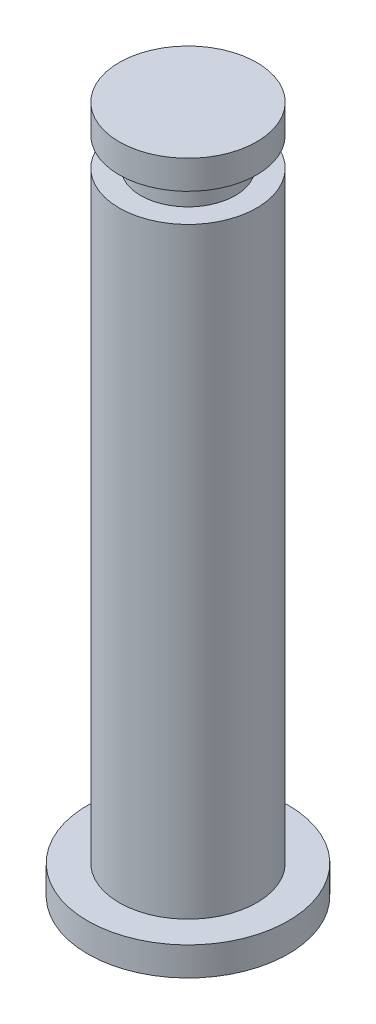
from build123d import *

# Parameters (mm, degrees)
CROQUIS1_R              = 3.5
CROQUIS1_R_2            = 2.4
SALIENTE_EXTRUIR1_DEPTH = 1
CROQUIS1_2_R            = 2.4
SALIENTE_EXTRUIR2_DEPTH = 24
CORTAR_EXTRUIR1_START   = -2
CROQUIS2_R              = 2.4
CROQUIS2_R_2            = 1.65
CORTAR_EXTRUIR1_DEPTH   = 1


with BuildPart() as part:
    # Croquis1 → Saliente-Extruir1 (new body)
    with BuildSketch(Plane(origin=(0, 0, 0), x_dir=(1, 0, 0), z_dir=(0, 1, 0))):
        Circle(CROQUIS1_R)
        Circle(CROQUIS1_R_2, mode=Mode.SUBTRACT)
    extrude(amount=SALIENTE_EXTRUIR1_DEPTH)

    # Croquis1<2> → Saliente-Extruir2 (add)
    with BuildSketch(Plane(origin=(0, 0, 0), x_dir=(1, 0, 0), z_dir=(0, 1, 0))):
        Circle(CROQUIS1_2_R)
    extrude(amount=SALIENTE_EXTRUIR2_DEPTH)

    # Croquis2 → Cortar-Extruir1 (cut)
    with BuildSketch(Plane(origin=(0, 24, 0), x_dir=(1, 0, 0), z_dir=(0, 1, 0)).offset(CORTAR_EXTRUIR1_START)):
        Circle(CROQUIS2_R)
        Circle(CROQUIS2_R_2, mode=Mode.SUBTRACT)
    extrude(amount=CORTAR_EXTRUIR1_DEPTH, mode=Mode.SUBTRACT)


solid = part.part
